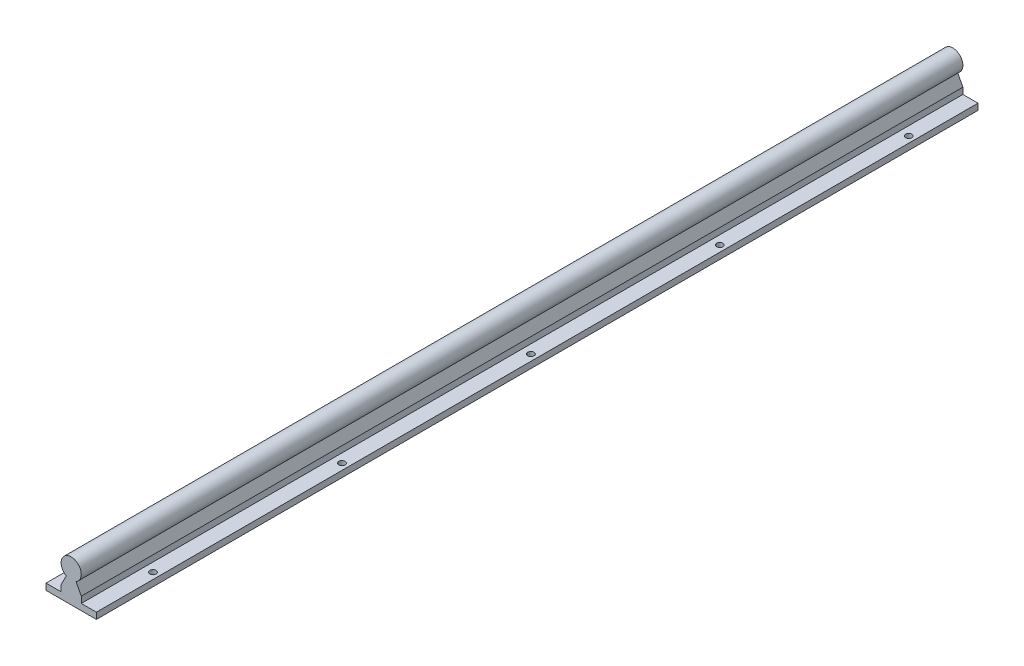
from build123d import *

# Parameters (mm, degrees)
BOSS_EXTRUDE3_DEPTH   = 700
BOSS_EXTRUDE4_DEPTH   = 700
F_5_0MM_DOWEL_HOLE1_D = 5
LPATTERN1_COUNT       = 5
LPATTERN1_PITCH       = 150


with BuildPart() as part:
    # Sketch2 → Boss-Extrude3 (new body)
    with BuildSketch(Plane.XY):
        with BuildLine():
            Line((-20, 5), (-20, 0))
            Line((-20, 0), (20, 0))
            Line((20, 0), (20, 5))
            Line((20, 5), (8, 5))
            Line((8, 5), (8, 10))
            Line((8, 10), (3.872983346, 18))
            ThreePointArc((3.872983346, 18), (0, 17), (-3.872983346, 18))
            Line((-3.872983346, 18), (-8, 10))
            Line((-8, 10), (-8, 5))
            Line((-8, 5), (-20, 5))
        make_face()
    extrude(amount=BOSS_EXTRUDE3_DEPTH)

    # Sketch2<4> → Boss-Extrude4 (add)
    with BuildSketch(Plane.XY):
        with BuildLine():
            ThreePointArc((8, 25), (-4.063012013, 31.891439137), (-3.872983346, 18))
            ThreePointArc((-3.872983346, 18), (0, 17), (3.872983346, 18))
            ThreePointArc((3.872983346, 18), (6.891439137, 20.936987987), (8, 25))
        make_face()
    extrude(amount=BOSS_EXTRUDE4_DEPTH)

    # Ø5.0mm Dowel Hole1 (through all)
    with Locations(Plane(origin=(0, 5, 0), x_dir=(1, 0, 0), z_dir=(0, 1, 0))):
        with Locations((15, -650), (-15, -650)):
            f_5_0mm_dowel_hole1 = Hole(F_5_0MM_DOWEL_HOLE1_D / 2)

    # LPattern1: Ø5.0mm Dowel Hole1 ×5
    with Locations(*[(0, 0, -i * LPATTERN1_PITCH) for i in range(1, LPATTERN1_COUNT)]):
        add(f_5_0mm_dowel_hole1, mode=Mode.SUBTRACT)


solid = part.part
